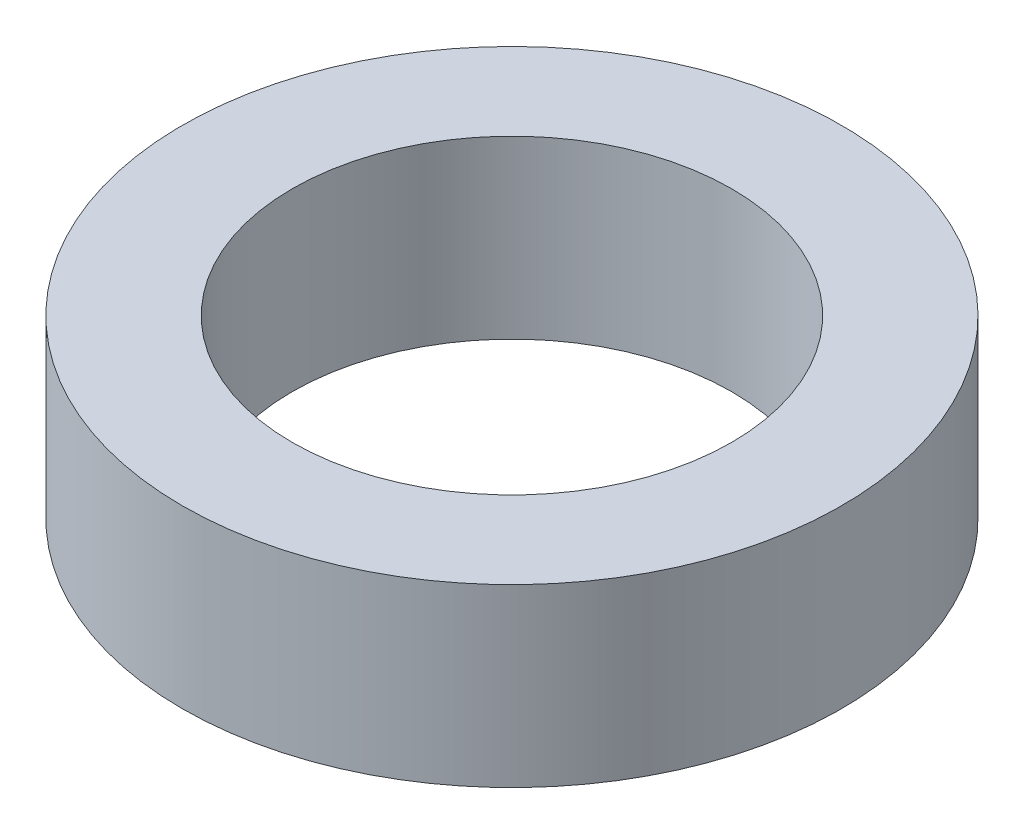
from build123d import *

# Parameters (mm, degrees)
SKETCH1_R           = 7.499999986
SKETCH1_R_2         = 5.000000033
BOSS_EXTRUDE1_DEPTH = 2.000000064


with BuildPart() as part:
    # Sketch1 → Boss-Extrude1 (new, symmetric)
    with BuildSketch(Plane(origin=(0, 0, 0), x_dir=(1, 0, 0), z_dir=(0, 1, 0))):
        with Locations(Location((0, 0, 0), (0, 0, 270))):
            Circle(SKETCH1_R)
        with Locations(Location((0, 0, 0), (0, 0, 270))):
            Circle(SKETCH1_R_2, mode=Mode.SUBTRACT)
    extrude(amount=BOSS_EXTRUDE1_DEPTH, both=True)


solid = part.part
